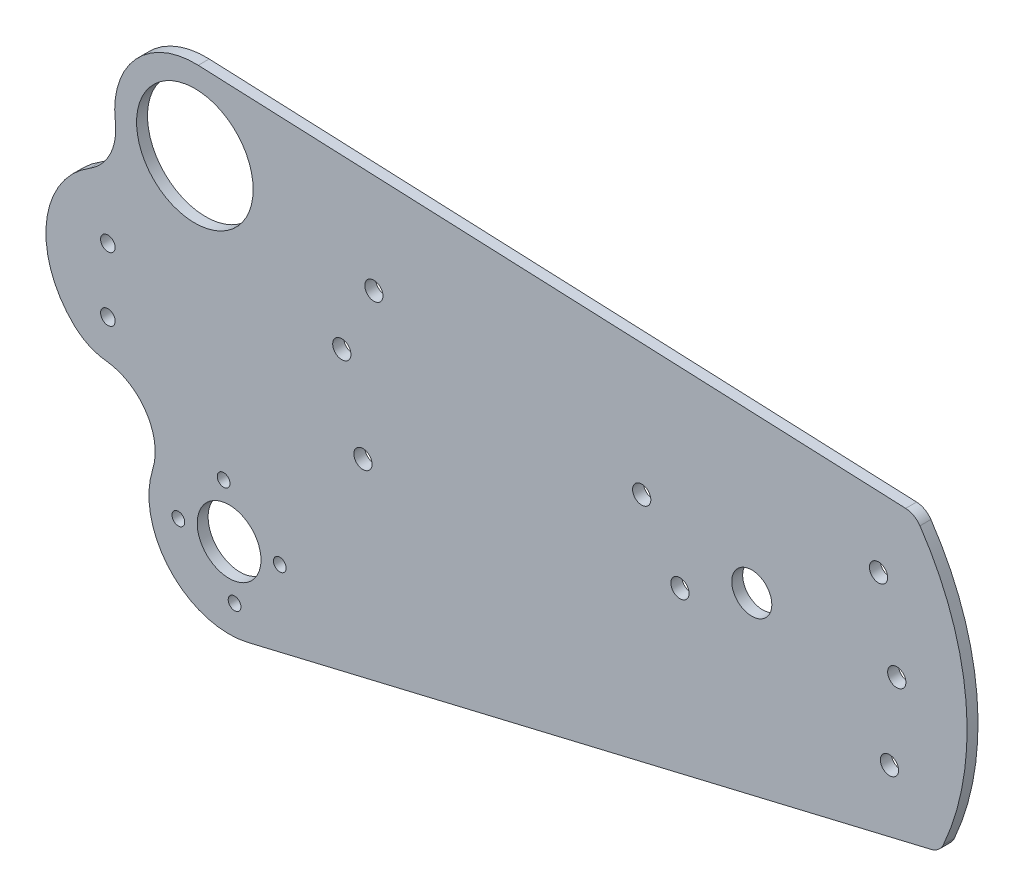
from build123d import *

# Parameters (mm, degrees)
SKETCH1_R           = 2
SKETCH1_R_2         = 2.5
SKETCH1_R_3         = 16
SKETCH1_R_4         = 5.5
SKETCH1_R_5         = 1.75
SKETCH1_R_6         = 8.75
BOSS_EXTRUDE1_DEPTH = 3


with BuildPart() as part:
    # Sketch1 → Boss-Extrude1 (new body)
    with BuildSketch(Plane.XY):
        with BuildLine():
            ThreePointArc((-113.495330616, 49.480245878), (-130.612542537, 42.401067653), (-136.25591702, 24.758334511))
            ThreePointArc((-136.25591702, 24.758334511), (-137.625807722, 16.377942391), (-143.326375164, 10.084207136))
            ThreePointArc((-143.326375164, 10.084207136), (-155.163766889, -8.600130856), (-147.542861296, -29.364285714))
            ThreePointArc((-147.542861296, -29.364285714), (-143.485319021, -32.119813239), (-138.755800817, -33.41913568))
            ThreePointArc((-138.755800817, -33.41913568), (-127.766910462, -40.113929411), (-126.009307035, -52.860960615))
            ThreePointArc((-126.009307035, -52.860960615), (-121.146348376, -74.473039246), (-99.946116444, -80.898027626))
            Line((-99.946116444, -80.898027626), (87.590394813, -36.326371398))
            ThreePointArc((87.590394813, -36.326371398), (89.625192833, -35.311277089), (91, -33.5))
            ThreePointArc((91, -33.5), (97.207593169, 3.616395989), (84.566874945, 39.061752622))
            ThreePointArc((84.566874945, 39.061752622), (82.864100425, 40.62017761), (80.642752625, 41.247667416))
            Line((80.642752625, 41.247667416), (-113.495330616, 49.480245878))
        make_face()
        with Locations((-138.3, -22.75)):
            Circle(SKETCH1_R, mode=Mode.SUBTRACT)
        with Locations((-68.3, -21.5)):
            Circle(SKETCH1_R_2, mode=Mode.SUBTRACT)
        with Locations((76.2, -22)):
            Circle(SKETCH1_R_2, mode=Mode.SUBTRACT)
        with Locations((-138.3, -5.25)):
            Circle(SKETCH1_R, mode=Mode.SUBTRACT)
        with Locations((-74.1, 1.7)):
            Circle(SKETCH1_R_2, mode=Mode.SUBTRACT)
        with Locations((-114.42742027, 27.5)):
            Circle(SKETCH1_R_3, mode=Mode.SUBTRACT)
        with Locations((-65.3, 20)):
            Circle(SKETCH1_R_2, mode=Mode.SUBTRACT)
        with Locations((18.7, -8.7)):
            Circle(SKETCH1_R_2, mode=Mode.SUBTRACT)
        with Locations((8.2, 8.3)):
            Circle(SKETCH1_R_2, mode=Mode.SUBTRACT)
        with Locations((38.40848029, 0)):
            Circle(SKETCH1_R_4, mode=Mode.SUBTRACT)
        with Locations((78.2, -0.1)):
            Circle(SKETCH1_R_2, mode=Mode.SUBTRACT)
        with Locations((73.2, 22.3)):
            Circle(SKETCH1_R_2, mode=Mode.SUBTRACT)
        with Locations((-106.536223939, -45.575160078)):
            Circle(SKETCH1_R_5, mode=Mode.SUBTRACT)
        with Locations((-103.530053908, -73.413316298)):
            Circle(SKETCH1_R_5, mode=Mode.SUBTRACT)
        with Locations((-118.952217033, -60.997323204)):
            Circle(SKETCH1_R_5, mode=Mode.SUBTRACT)
        with Locations((-105.033138923, -59.494238188)):
            Circle(SKETCH1_R_6, mode=Mode.SUBTRACT)
        with Locations((-91.114060813, -57.991153173)):
            Circle(SKETCH1_R_5, mode=Mode.SUBTRACT)
    extrude(amount=BOSS_EXTRUDE1_DEPTH)


solid = part.part
